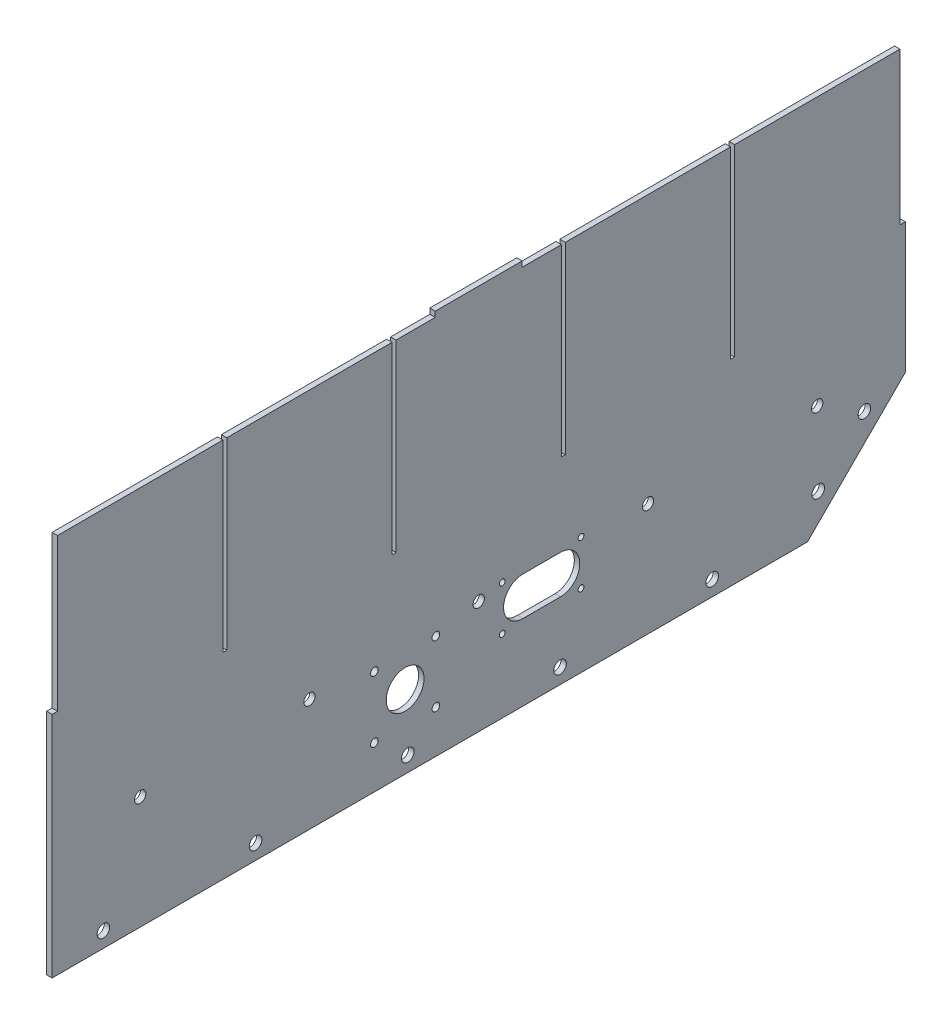
from build123d import *

# Parameters (mm, degrees)
SKETCH1_W            = 498.348
SKETCH1_H            = 165.1
BOSS_EXTRUDE1_DEPTH  = 1.5875
BOSS_EXTRUDE2_DEPTH  = 3.175
CUT_EXTRUDE1_DEPTH   = 286.681383539
LPATTERN1_COUNT      = 5
LPATTERN1_PITCH      = 88.9
CUT_EXTRUDE2_DEPTH   = 286.681383539
LPATTERN2_COUNT      = 2
LPATTERN2_PITCH      = 38.1
SKETCH5_W            = 3.175
SKETCH5_H            = 88.9
CUT_EXTRUDE3_DEPTH   = 286.681383539
SKETCH6_W            = 2.286
SKETCH6_H            = 107.442
CUT_EXTRUDE4_DEPTH   = 286.681383539
LPATTERN3_COUNT      = 4
LPATTERN3_PITCH      = 98.8568
SKETCH8_W            = 50.8
SKETCH8_H            = 3.175
BOSS_EXTRUDE3_DEPTH  = 3.175
SKETCH9_R            = 11.05
CUT_EXTRUDE5_DEPTH   = 286.681383539
M6_CLEARANCE_HOLE1_D = 6.6
LPATTERN4_COUNT      = 3
LPATTERN4_PITCH      = 98.8568
LPATTERN4_COL_COUNT  = 3
LPATTERN4_COL_PITCH  = 98.8568
M4_CLEARANCE_HOLE1_D = 4.5
CUT_EXTRUDE6_DEPTH   = 286.681383539
M3_CLEARANCE_HOLE1_D = 3.4


with BuildPart() as part:
    # Sketch1 → Boss-Extrude1 (new, symmetric)
    with BuildSketch(Plane(origin=(0, 0, 0), x_dir=(0, 0, -1), z_dir=(1, 0, 0))):
        Rectangle(SKETCH1_W, SKETCH1_H)
    extrude(amount=BOSS_EXTRUDE1_DEPTH, both=True)

    # Sketch2 → Boss-Extrude2 (add)
    with BuildSketch(Plane(origin=(1.5875, 0, 0), x_dir=(0, 0, -1), z_dir=(1, 0, 0))):
        Polygon((192.024, -139.7), (249.174, -82.55), (-249.174, -82.55), (-249.174, -139.7), align=None)
    extrude(amount=-BOSS_EXTRUDE2_DEPTH)

    # Sketch3 → Cut-Extrude1 (cut, through all)
    with BuildSketch(Plane.ZY.offset(1.5875)):
        with BuildLine():
            ThreePointArc((222.877, -130.81), (216.603382579, -128.211382579), (219.202, -134.485))
            Line((219.202, -134.485), (219.202, -130.81))
            Line((219.202, -130.81), (222.877, -130.81))
        make_face()
        with BuildLine():
            Line((219.202, -130.81), (219.202, -134.485))
            ThreePointArc((219.202, -134.485), (221.800617421, -133.408617421), (222.877, -130.81))
            Line((222.877, -130.81), (219.202, -130.81))
        make_face()
    cut_extrude1 = extrude(amount=-CUT_EXTRUDE1_DEPTH, mode=Mode.SUBTRACT)

    # LPattern1: Cut-Extrude1 ×5
    with Locations(*[(0, 0, -i * LPATTERN1_PITCH) for i in range(1, LPATTERN1_COUNT)]):
        add(cut_extrude1, mode=Mode.SUBTRACT)

    # Sketch4 → Cut-Extrude2 (cut, symmetric)
    with BuildSketch(Plane.ZY.offset(1.5875)):
        with BuildLine():
            ThreePointArc((-194.635179285, -117.249359697), (-199.716540899, -113.854102415), (-200.908796706, -119.847977118))
            Line((-200.908796706, -119.847977118), (-198.310179285, -117.249359697))
            Line((-198.310179285, -117.249359697), (-195.711561864, -119.847977118))
            ThreePointArc((-195.711561864, -119.847977118), (-194.914922003, -118.655721311), (-194.635179285, -117.249359697))
        make_face()
        with BuildLine():
            Line((-198.310179285, -117.249359697), (-200.908796706, -119.847977118))
            ThreePointArc((-200.908796706, -119.847977118), (-198.310179285, -120.924359697), (-195.711561864, -119.847977118))
            Line((-195.711561864, -119.847977118), (-198.310179285, -117.249359697))
        make_face()
    cut_extrude2 = extrude(amount=CUT_EXTRUDE2_DEPTH, both=True, mode=Mode.SUBTRACT)

    # LPattern2: Cut-Extrude2 ×2
    with Locations(*[Vector(0, 0.7071067811865446, -0.7071067811865507) * (i * LPATTERN2_PITCH) for i in range(1, LPATTERN2_COUNT)]):
        add(cut_extrude2, mode=Mode.SUBTRACT)

    # Sketch5 → Cut-Extrude3 (cut, through all)
    with BuildSketch(Plane(origin=(1.5875, 0, 0), x_dir=(0, 0, -1), z_dir=(1, 0, 0))):
        with Locations((247.5865, 38.1)):
            Rectangle(SKETCH5_W, SKETCH5_H)
        with Locations((-247.5865, 38.1)):
            Rectangle(SKETCH5_W, SKETCH5_H)
    extrude(amount=-CUT_EXTRUDE3_DEPTH, mode=Mode.SUBTRACT)

    # Sketch6 → Cut-Extrude4 (cut, through all)
    with BuildSketch(Plane(origin=(1.5875, 0, 0), x_dir=(0, 0, -1), z_dir=(1, 0, 0))):
        with Locations((148.2852, 28.829)):
            Rectangle(SKETCH6_W, SKETCH6_H)
    cut_extrude4 = extrude(amount=-CUT_EXTRUDE4_DEPTH, mode=Mode.SUBTRACT)

    # LPattern3: Cut-Extrude4 ×4
    with Locations(*[(0, 0, i * LPATTERN3_PITCH) for i in range(1, LPATTERN3_COUNT)]):
        add(cut_extrude4, mode=Mode.SUBTRACT)

    # Sketch8 → Boss-Extrude3 (add)
    with BuildSketch(Plane(origin=(1.5875, 0, 0), x_dir=(0, 0, -1), z_dir=(1, 0, 0))):
        with Locations((0, 84.1375)):
            Rectangle(SKETCH8_W, SKETCH8_H)
    extrude(amount=-BOSS_EXTRUDE3_DEPTH)

    # Sketch9 → Cut-Extrude5 (cut, through all)
    with BuildSketch(Plane(origin=(1.5875, 0, 0), x_dir=(0, 0, -1), z_dir=(1, 0, 0))):
        with Locations((-42.9768, -96.7994)):
            Circle(SKETCH9_R)
    extrude(amount=-CUT_EXTRUDE5_DEPTH, mode=Mode.SUBTRACT)

    # M6 Clearance Hole1 (through all)
    with Locations(Plane(origin=(1.5875, 0, 0), x_dir=(0, 0, -1), z_dir=(1, 0, 0))):
        with Locations((0, -73.8124)):
            m6_clearance_hole1 = Hole(M6_CLEARANCE_HOLE1_D / 2)

    # LPattern4: M6 Clearance Hole1 ×3
    with Locations(*[(0, 0, i * LPATTERN4_PITCH) for i in range(1, LPATTERN4_COUNT)]):
        add(m6_clearance_hole1, mode=Mode.SUBTRACT)

    # LPattern4 col: M6 Clearance Hole1 ×3
    with Locations(*[(0, 0, -i * LPATTERN4_COL_PITCH) for i in range(1, LPATTERN4_COL_COUNT)]):
        add(m6_clearance_hole1, mode=Mode.SUBTRACT)

    # M4 Clearance Hole1 (through all)
    with Locations(Plane(origin=(1.5875, 0, 0), x_dir=(0, 0, -1), z_dir=(1, 0, 0))):
        with Locations((-25.0163, -78.8389), (-60.9373, -78.8389), (-60.9373, -114.7599), (-25.0163, -114.7599)):
            Hole(M4_CLEARANCE_HOLE1_D / 2)

    # Sketch14 → Cut-Extrude6 (cut, through all)
    with BuildSketch(Plane(origin=(1.5875, 0, 0), x_dir=(0, 0, -1), z_dir=(1, 0, 0))):
        with BuildLine():
            Line((47.7662, -95.3542), (25.7662, -95.3542))
            ThreePointArc((25.7662, -95.3542), (14.5162, -84.1042), (25.7662, -72.8542))
            Line((25.7662, -72.8542), (47.7662, -72.8542))
            ThreePointArc((47.7662, -72.8542), (59.0162, -84.1042), (47.7662, -95.3542))
        make_face()
    extrude(amount=-CUT_EXTRUDE6_DEPTH, mode=Mode.SUBTRACT)

    # M3 Clearance Hole1 (through all)
    with Locations(Plane(origin=(1.5875, 0, 0), x_dir=(0, 0, -1), z_dir=(1, 0, 0))):
        with Locations((59.7662, -97.1042), (59.7662, -71.1042), (13.7662, -71.1042), (13.7662, -97.1042)):
            Hole(M3_CLEARANCE_HOLE1_D / 2)


solid = part.part
